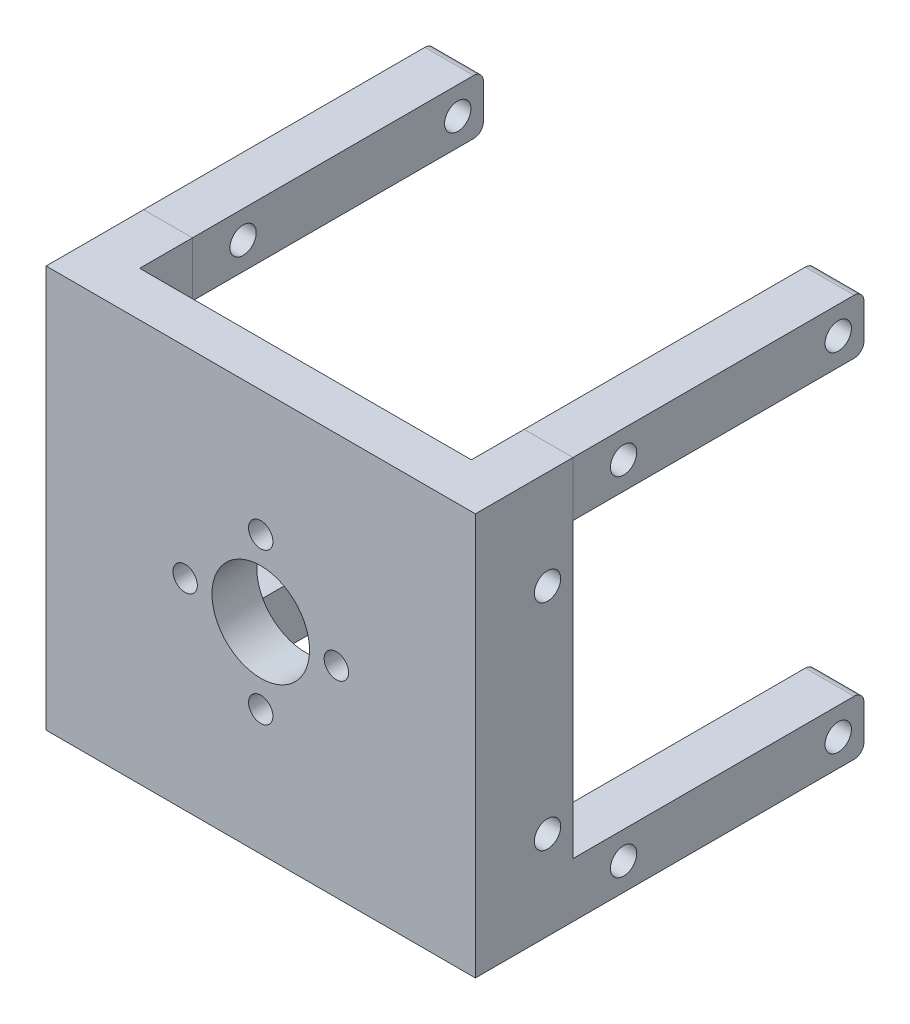
from build123d import *

# Parameters (mm, degrees)
BOSS_EXTRUDE1_DEPTH   = 41.2
SKETCH4_R             = 1.349999999999999
SKETCH4_R_2           = 1.3500000000000005
CUT_EXTRUDE3_DEPTH    = 61.74281850556493
SKETCH6_W             = 5.000000000000002
SKETCH6_H             = 29.82
BOSS_EXTRUDE2_DEPTH   = 5.6
SKETCH6_W_2           = 5.0000000000000036
SKETCH6_H_2           = 29.819999999999997
BOSS_EXTRUDE2_2_DEPTH = 5.6
BOSS_EXTRUDE3_DEPTH   = 5.6
SKETCH8_R             = 1.3499999999999985
SKETCH8_R_2           = 1.3499999999999979
SKETCH8_R_3           = 1.3500000000000005
CUT_EXTRUDE5_DEPTH    = 74.60000000000002
FILLET4_R             = 1
FILLET5_R             = 1
FILLET6_R             = 1
FILLET7_R             = 1
SKETCH10_R            = 5.000000000000001
CUT_EXTRUDE7_DEPTH    = 2.9999999999999862
CUT_EXTRUDE8_START    = -3.9999999999999725
SKETCH11_R            = 1.2500000000000004
CUT_EXTRUDE8_DEPTH    = 7.1999999999999575
CIRPATTERN1_COUNT     = 4
BOSS_EXTRUDE4_DEPTH   = 41.2
CUT_EXTRUDE9_START    = -5.199999999999999
SKETCH13_R            = 5.000000000000001
SKETCH13_R_2          = 1.2499999999999998
SKETCH13_R_3          = 1.25
SKETCH13_R_4          = 1.2500000000000004
SKETCH13_R_5          = 1.2499999999999996
CUT_EXTRUDE9_DEPTH    = 5.199999999999999


with BuildPart() as part:
    # Sketch1 → Boss-Extrude1 (new body)
    with BuildSketch(Plane(origin=(0, 0, 0), x_dir=(1, 0, 0), z_dir=(0, 1, 0))):
        Polygon((-21.499999999999943, 2.0899999999999994), (12.500000000000053, 2.0899999999999994), (12.500000000000053, 7.5), (17.500000000000053, 7.500000000000002), (17.500000000000053, 0.5000000000000013), (17.500000000000053, -0.4999999999999987), (-26.499999999999943, -0.49999999999999956), (-26.499999999999943, 0.4999999999999961), (-26.499999999999943, 7.4999999999999964), (-21.499999999999943, 7.4999999999999964), align=None)
    extrude(amount=BOSS_EXTRUDE1_DEPTH)

    # Sketch4 → Cut-Extrude3 (cut, through all)
    with BuildSketch(Plane(origin=(17.500000000000053, 0, 0), x_dir=(0, 0, -1), z_dir=(1, 0, 0))):
        with Locations((4.8900000000000015, 31.099999999999998)):
            Circle(SKETCH4_R)
        with Locations((4.8900000000000015, 9.1)):
            Circle(SKETCH4_R_2)
    extrude(amount=-CUT_EXTRUDE3_DEPTH, mode=Mode.SUBTRACT)

    # Sketch7 → Boss-Extrude3 (add)
    with BuildSketch(Plane.XZ):
        Polygon((17.500000000000053, -7.500000000000002), (12.500000000000053, -7.500000000000001), (12.500000000000057, -37.32000000000001), (17.500000000000057, -37.32), align=None)
        Polygon((-21.499999999999943, -7.4999999999999964), (-26.499999999999943, -7.499999999999997), (-26.499999999999936, -37.32), (-21.49999999999994, -37.31999999999999), align=None)
    extrude(amount=-BOSS_EXTRUDE3_DEPTH)


with BuildPart() as body_2:
    # Sketch6 → Boss-Extrude2 (new body)
    with BuildSketch(Plane(origin=(0, 41.2, 0), x_dir=(1, 0, 0), z_dir=(0, 1, 0))):
        with Locations((15.000000000000053, 22.41)):
            Rectangle(SKETCH6_W, SKETCH6_H)
    extrude(amount=-BOSS_EXTRUDE2_DEPTH)


with BuildPart() as body_3:
    # Sketch6 → Boss-Extrude2 2 (new body)
    with BuildSketch(Plane(origin=(0, 41.2, 0), x_dir=(1, 0, 0), z_dir=(0, 1, 0))):
        with Locations((-23.999999999999943, 22.409999999999997)):
            Rectangle(SKETCH6_W_2, SKETCH6_H_2)
    extrude(amount=-BOSS_EXTRUDE2_2_DEPTH)


with BuildPart() as cut_extrude5_tool:
    # Sketch8 → Cut-Extrude5 (new body)
    with BuildSketch(Plane(origin=(17.500000000000053, 0, 0), x_dir=(0, 0, -1), z_dir=(1, 0, 0))):
        with Locations((34.69, 2.799999999999997)):
            Circle(SKETCH8_R)
        with Locations((34.69, 38.400000000000006)):
            Circle(SKETCH8_R_2)
        with Locations((12.690000000000001, 38.4)):
            Circle(SKETCH8_R_2)
        with Locations((12.690000000000001, 2.799999999999997)):
            Circle(SKETCH8_R_3)
    extrude(amount=-CUT_EXTRUDE5_DEPTH)


with BuildPart() as part_1:
    add(part.part)

    # Cut-Extrude5: cut by cut_extrude5_tool
    add(cut_extrude5_tool.part, mode=Mode.SUBTRACT)

    # Fillet6
    fillet6_edges = [part_1.edges().sort_by_distance(p)[0] for p in [
        (15.000000000000057, 5.6, -37.32000000000001),
        (15.000000000000057, 0, -37.32000000000001),
    ]]
    fillet(fillet6_edges, radius=FILLET6_R)

    # Fillet7
    fillet7_edges = [part_1.edges().sort_by_distance(p)[0] for p in [
        (-23.999999999999936, 5.6, -37.31999999999999),
        (-23.999999999999936, 0, -37.31999999999999),
    ]]
    fillet(fillet7_edges, radius=FILLET7_R)

    # Sketch10 → Cut-Extrude7 (cut)
    with BuildSketch(Plane(origin=(0, 0, -2.0899999999999994), x_dir=(-1, 0, 0), z_dir=(0, 0, -1))):
        with Locations((4.499999999999945, 20.6)):
            Circle(SKETCH10_R)
    extrude(amount=-CUT_EXTRUDE7_DEPTH, mode=Mode.SUBTRACT)

    # Sketch11 → Cut-Extrude8 (cut)
    with BuildSketch(Plane.XY.offset(0.49999999999999906).offset(CUT_EXTRUDE8_START)):
        with Locations(Location((-4.499999999999943, 28.35, 0), (0, 0, 180))):
            Circle(SKETCH11_R)
    cut_extrude8 = extrude(amount=CUT_EXTRUDE8_DEPTH, mode=Mode.SUBTRACT)

    # CirPattern1: Cut-Extrude8 ×4 about axis
    cirpattern1_axis = Axis((-4.499999999999932, 20.600000000000005, 0), (0, 0, 1))
    for i in range(1, CIRPATTERN1_COUNT):
        add(cut_extrude8.rotate(cirpattern1_axis, i * 360 / CIRPATTERN1_COUNT), mode=Mode.SUBTRACT)

    # Sketch12 → Boss-Extrude4 (add)
    with BuildSketch(Plane.XZ):
        Polygon((17.500000000000053, 0.4999999999999987), (-26.499999999999943, 0.4999999999999987), (-26.499999999999943, 2.4999999999999933), (17.500000000000053, 2.4999999999999987), align=None)
    extrude(amount=-BOSS_EXTRUDE4_DEPTH)

    # Sketch13 → Cut-Extrude9 (cut)
    with BuildSketch(Plane.XY.offset(2.4999999999999964).offset(CUT_EXTRUDE9_START)):
        with Locations(Location((-4.499999999999945, 20.6, 0), (0, 0, 180))):
            Circle(SKETCH13_R)
        with Locations((-4.499999999999947, 12.85)):
            Circle(SKETCH13_R_2)
        with Locations((3.2500000000000555, 20.599999999999973)):
            Circle(SKETCH13_R_3)
        with Locations((-4.499999999999943, 28.35)):
            Circle(SKETCH13_R_4)
        with Locations((-12.249999999999945, 20.600000000000083)):
            Circle(SKETCH13_R_5)
    extrude(amount=CUT_EXTRUDE9_DEPTH, mode=Mode.SUBTRACT)


with BuildPart() as body_2_1:
    add(body_2.part)

    # Cut-Extrude5: cut by cut_extrude5_tool
    add(cut_extrude5_tool.part, mode=Mode.SUBTRACT)

    # Fillet5
    fillet5_edges = [body_2_1.edges().sort_by_distance(p)[0] for p in [
        (15.000000000000053, 35.6, -37.32),
        (15.000000000000053, 41.2, -37.32),
    ]]
    fillet(fillet5_edges, radius=FILLET5_R)


with BuildPart() as body_3_1:
    add(body_3.part)

    # Cut-Extrude5: cut by cut_extrude5_tool
    add(cut_extrude5_tool.part, mode=Mode.SUBTRACT)

    # Fillet4
    fillet4_edges = [body_3_1.edges().sort_by_distance(p)[0] for p in [
        (-23.999999999999943, 35.6, -37.31999999999999),
        (-23.999999999999943, 41.2, -37.31999999999999),
    ]]
    fillet(fillet4_edges, radius=FILLET4_R)


solid = Compound([part_1.part, body_2_1.part, body_3_1.part])
